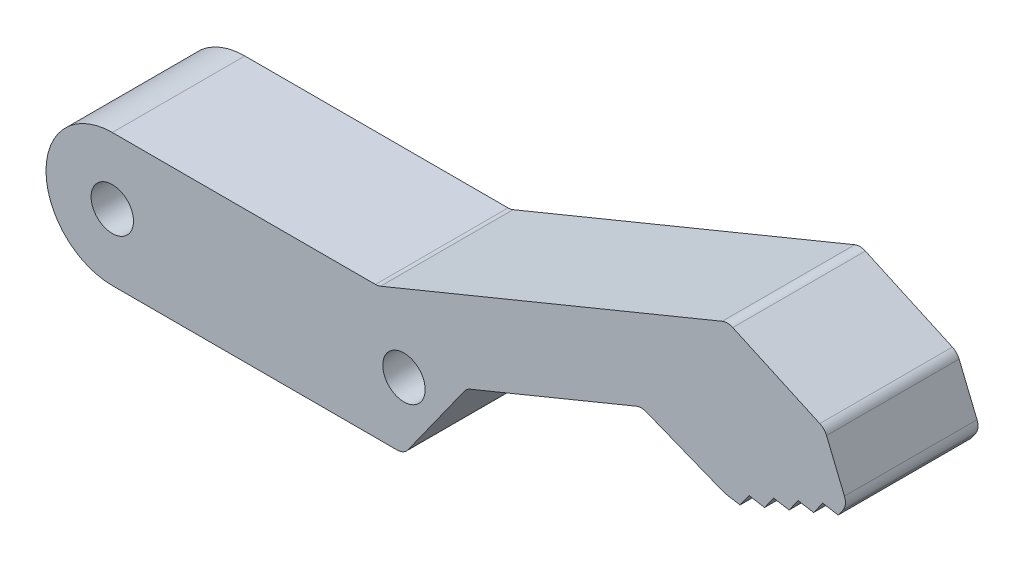
from build123d import *

# Parameters (mm, degrees)
SKETCH1_R            = 1.5
BOSS_EXTRUDE1_DEPTH  = 10
FILLET1_R            = 1
M3_CLEARANCE_HOLE1_D = 3.2


with BuildPart() as part:
    # Sketch1 → Boss-Extrude1 (new body)
    with BuildSketch(Plane.XY):
        with BuildLine():
            Line((20.05, 5), (0, 5))
            ThreePointArc((0, 5), (-5, 0), (0, -5))
            Line((0, -5), (22, -5))
            Line((22, -5), (26.72989842, 1.621129525))
            Line((26.72989842, 1.621129525), (39.900164389, 7.036080522))
            Line((39.900164389, 7.036080522), (46.188488025, 4.540007042))
            Line((46.188488025, 4.540007042), (47.351030887, 4.342221563))
            Line((47.351030887, 4.342221563), (48.038244482, 5.300533868))
            Line((48.038244482, 5.300533868), (49.200787343, 5.102748388))
            Line((49.200787343, 5.102748388), (49.888000938, 6.061060693))
            Line((49.888000938, 6.061060693), (51.050543799, 5.863275214))
            Line((51.050543799, 5.863275214), (51.737757394, 6.821587519))
            Line((51.737757394, 6.821587519), (52.900300256, 6.623802039))
            Line((52.900300256, 6.623802039), (53.587513851, 7.582114344))
            Line((53.587513851, 7.582114344), (54.750056712, 7.384328864))
            Line((54.750056712, 7.384328864), (55.437270307, 8.34264117))
            Line((55.437270307, 8.34264117), (53.72608495, 12.504593197))
            Line((53.72608495, 12.504593197), (46.409029503, 15.837507263))
            Line((46.409029503, 15.837507263), (20.05, 5))
        make_face()
        Circle(SKETCH1_R, mode=Mode.SUBTRACT)
        with Locations((22, 0)):
            Circle(SKETCH1_R, mode=Mode.SUBTRACT)
    extrude(amount=BOSS_EXTRUDE1_DEPTH)

    # Fillet1
    fillet1_edges = [part.edges().sort_by_distance(p)[0] for p in [
        (22, -5, 5),
        (20.05, 5, 5),
        (46.409029503, 15.837507263, 5),
        (53.72608495, 12.504593197, 5),
        (55.437270307, 8.34264117, 5),
        (46.188488025, 4.540007042, 5),
        (39.900164389, 7.036080522, 5),
        (26.72989842, 1.621129525, 5),
    ]]
    fillet(fillet1_edges, radius=FILLET1_R)

    # M3 Clearance Hole1 (through all)
    with Locations(Plane.XY.offset(10)):
        with Locations((0, 0), (22, 0)):
            Hole(M3_CLEARANCE_HOLE1_D / 2)


solid = part.part
